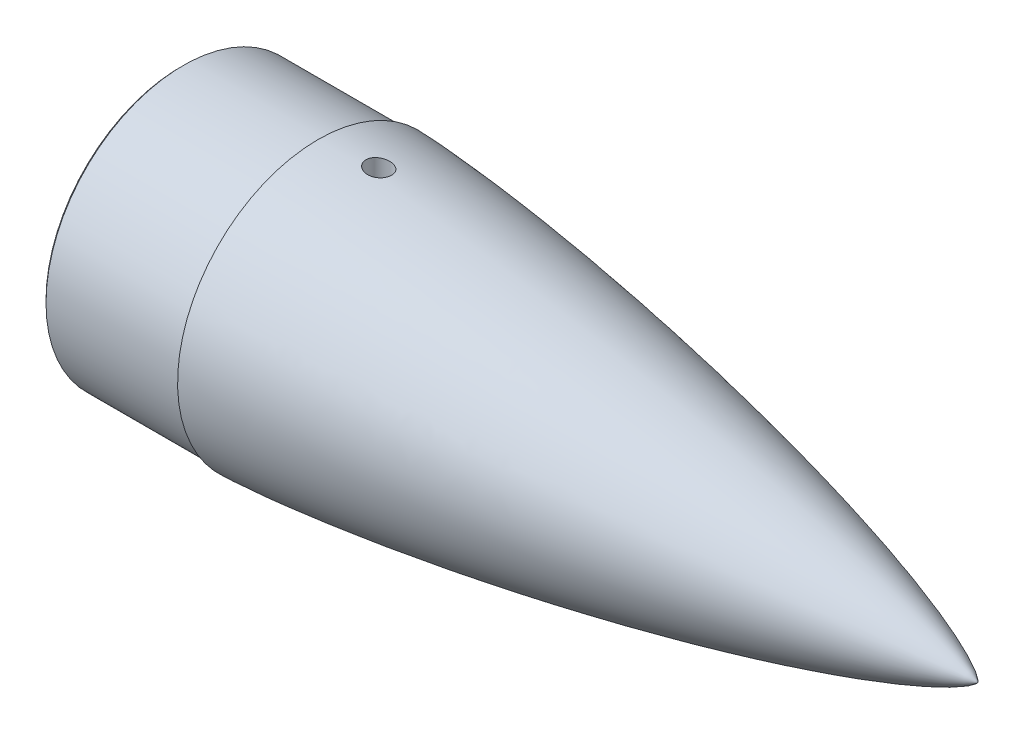
from build123d import *

# Parameters (mm, degrees)
CHAMFER1_SIZE                    = 1.5
F_96_0_0063_DIAMETER_HOLE1_D     = 6.7564
F_96_0_0063_DIAMETER_HOLE1_DEPTH = 9.53
CIRPATTERN1_COUNT                = 6
SKETCH20_W                       = 40
SKETCH20_H                       = 40
CUT_EXTRUDE3_DEPTH               = 12
SKETCH22_R                       = 7.5
CUT_EXTRUDE4_DEPTH               = 444.206648903


with BuildPart() as part:
    # Sketch10 → Revolve1 (revolve)
    with BuildSketch(Plane.XY, mode=Mode.PRIVATE) as revolve1_sk:
        with BuildLine():
            Line((11.112493743, 81.99983), (11.112493743, 67.49983))
            Line((11.112493743, 67.49983), (129.304508698, 67.49983))
            add(Edge.make_bspline(
                [(368.967251823, 0), (368.965299543, 0.012338489), (368.959416882, 0.036518378), (368.940636147, 0.082964007), (368.902304552, 0.158736421), (368.845538097, 0.250270687), (368.755690124, 0.376555746), (368.616653262, 0.54835284), (368.392888737, 0.793577299), (368.008659121, 1.164904965), (367.344738263, 1.729853685), (366.176060796, 2.601559154), (364.09282389, 3.960032328), (360.425978756, 6.040734396), (354.402196649, 9.01831007), (344.042994901, 13.507695011), (329.152005398, 19.128483965), (310.425167902, 25.398569259), (288.741266406, 31.933693508), (266.378532845, 38.106125474), (243.901379123, 43.846895186), (221.331994001, 49.212017941), (198.683967629, 54.234500927), (175.966897581, 58.934255644), (156.034567874, 62.771715365), (141.509051931, 65.395628269), (132.679425236, 66.924517444), (129.562757302, 67.455859883), (129.304508698, 67.49983)],
                knots=[0, 0, 0, 0, 0, 0.000134949, 0.000269899, 0.000539798, 0.000919537, 0.001299277, 0.001947431, 0.00293136, 0.004511869, 0.007081312, 0.011380263, 0.018707867, 0.031423867, 0.052705479, 0.084103008, 0.140910136, 0.203703492, 0.266497064, 0.329290816, 0.392084375, 0.454877964, 0.517671564, 0.580465191, 0.643258828, 0.674655593, 0.677492072, 0.677492072, 0.677492072, 0.677492072, 0.677492072], degree=4))
            Line((368.967251823, 0), (408.967251823, 0))
            add(Edge.make_bspline(
                [(408.967251823, 0), (408.964913524, 0.013501739), (408.958040758, 0.039916077), (408.936520441, 0.090485698), (408.892222076, 0.174057132), (408.826281575, 0.275556803), (408.721696416, 0.415833756), (408.561101809, 0.605075245), (408.30561918, 0.87242415), (407.86966713, 1.275299562), (407.120955138, 1.885142115), (405.803773451, 2.82590185), (403.46240692, 4.287152794), (399.325294488, 6.531818454), (392.481146888, 9.758904649), (380.662076725, 14.628008466), (363.637187185, 20.711720382), (342.215241093, 27.476512989), (317.428462321, 34.49762647), (291.879335737, 41.10482439), (266.21046092, 47.228993169), (240.44548836, 52.933436777), (214.598861982, 58.255439009), (188.68089566, 63.217582693), (165.946174917, 67.253280679), (146.421982586, 70.493799722), (130.127893898, 73.044947468), (117.078590637, 74.994157933), (104.015464216, 76.84854079), (92.573263959, 78.384492045), (82.757139441, 79.635603973), (74.571340184, 80.632219902), (68.019260454, 81.400804211), (61.463723364, 82.139375899), (54.90469802, 82.84637726), (48.342159918, 83.519940506), (41.776057559, 84.15778717), (36.02754108, 84.682157239), (31.097921259, 85.105234912), (26.988317923, 85.438669825), (23.699666618, 85.693218594), (20.085807822, 85.958448038), (16.719873821, 86.189018485), (13.602098287, 86.386966779), (10.732704013, 86.554575744), (8.436635008, 86.678703291), (6.139997341, 86.792157585), (4.129892063, 86.879313264), (2.40653858, 86.944618982), (1.257348635, 86.979022496), (0.68269791, 86.99491462), (0.395312527, 86.99983)],
                knots=[0, 0, 0, 0, 0, 0.000130123, 0.000260245, 0.000520491, 0.000900391, 0.00128029, 0.001925099, 0.002881508, 0.004418208, 0.006927086, 0.011110697, 0.018279138, 0.03067276, 0.051704469, 0.08310228, 0.139908797, 0.202702513, 0.265496165, 0.328289682, 0.391083359, 0.453876973, 0.516670577, 0.579464197, 0.642257765, 0.673654596, 0.705051427, 0.736448267, 0.767845106, 0.799241874, 0.814940257, 0.830638641, 0.846337073, 0.862035505, 0.877733936, 0.893432368, 0.90913072, 0.924829072, 0.932678248, 0.940527424, 0.9483766, 0.956225776, 0.967169332, 0.97264111, 0.978112888, 0.983584666, 0.989056444, 0.994528222, 0.997264111, 1, 1, 1, 1, 1], degree=4))
            Line((0.395312527, 86.99983), (0.395312527, 84.99983))
            Line((0.395312527, 84.99983), (-84.604517473, 84.99983))
            Line((-84.604517473, 84.99983), (-84.604517473, 81.99983))
            Line((-84.604517473, 81.99983), (11.112493743, 81.99983))
        make_face()
    revolve(revolve1_sk.sketch.rotate(Axis((46.917858469, 0, 0), (-1, 0, 0)), 90), axis=Axis((46.917858469, 0, 0), (-1, 0, 0)))

    # Chamfer1
    chamfer1_edges = [part.edges().sort_by_distance(p)[0] for p in [
        (-84.604517473, 0, 84.99983),
    ]]
    chamfer(chamfer1_edges, length=CHAMFER1_SIZE)

    # #96 (0.0063) Diameter Hole1
    with Locations(Plane.ZY.offset(-11.112493743)):
        with Locations((-36.562415, 63.327960427)):
            f_96_0_0063_diameter_hole1 = Hole(F_96_0_0063_DIAMETER_HOLE1_D / 2, depth=F_96_0_0063_DIAMETER_HOLE1_DEPTH)

    # CirPattern1: #96 (0.0063) Diameter Hole1 ×6 about axis
    cirpattern1_axis = Axis((0, 0, 0), (1, 0, 0))
    for i in range(1, CIRPATTERN1_COUNT):
        add(f_96_0_0063_diameter_hole1.rotate(cirpattern1_axis, i * 360 / CIRPATTERN1_COUNT), mode=Mode.SUBTRACT)

    # Sketch20 → Cut-Extrude3 (cut)
    with BuildSketch(Plane(origin=(0, 60, 0), x_dir=(1, 0, 0), z_dir=(0, 1, 0))):
        with Locations((44.770184194, 5)):
            Rectangle(SKETCH20_W, SKETCH20_H)
    extrude(amount=CUT_EXTRUDE3_DEPTH, mode=Mode.SUBTRACT)

    # Sketch22 → Cut-Extrude4 (cut, through all)
    with BuildSketch(Plane(origin=(0, 60, 0), x_dir=(1, 0, 0), z_dir=(0, 1, 0))):
        with Locations(Location((32, 6, 0), (0, 0, 164.574138151))):
            Circle(SKETCH22_R)
    extrude(amount=CUT_EXTRUDE4_DEPTH, mode=Mode.SUBTRACT)


solid = part.part
